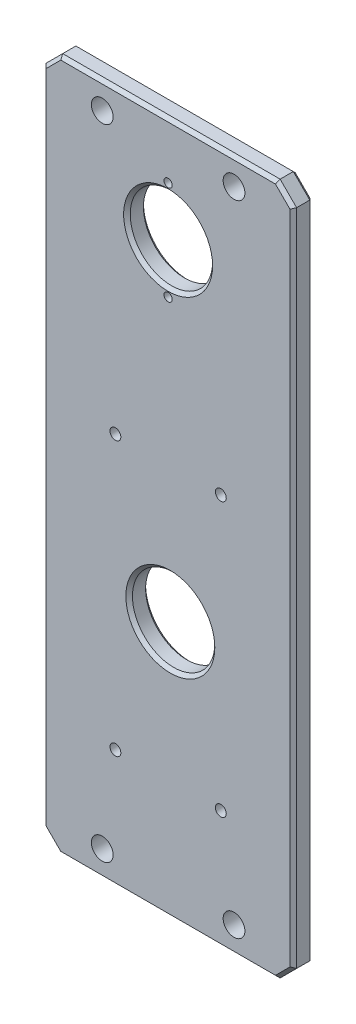
from build123d import *

# Parameters (mm, degrees)
SKETCH_1_W             = 76
SKETCH_1_H             = 210
EXTRUDE_1_DEPTH        = 6
SKETCH_2_R             = 3.3
CUT_EXTRUDE_1_DEPTH    = 112.825757319
CHAMFER_2_SIZE         = 5
CHAMFER_1_SIZE         = 1
HOLE_WIZARD_M4_1_D     = 3.3
HOLE_WIZARD_M4_1_DEPTH = 10.1
HOLE_WIZARD_M4_1_TIP   = 0.991420021
HOLE_WIZARD_M3_1_D     = 2.5
HOLE_WIZARD_M3_1_DEPTH = 7.5
HOLE_WIZARD_M3_1_TIP   = 0.751075774
SKETCH_7_R             = 12.5
CUT_EXTRUDE_2_DEPTH    = 112.825757319
SKETCH_8_R             = 12.5
CUT_EXTRUDE_3_DEPTH    = 112.825757319
CHAMFER_3_SIZE         = 1


with BuildPart() as part:
    # 草图1 → 凸台-拉伸1 (new body)
    with BuildSketch(Plane.XY):
        Rectangle(SKETCH_1_W, SKETCH_1_H)
    extrude(amount=EXTRUDE_1_DEPTH)

    # 草图2 → 切除-拉伸1 (cut, through all)
    with BuildSketch(Plane.XY.offset(6)):
        with Locations((-20, 97)):
            Circle(SKETCH_2_R)
        with Locations((20, 97)):
            Circle(SKETCH_2_R)
        with Locations((-20, -97)):
            Circle(SKETCH_2_R)
        with Locations((20, -97)):
            Circle(SKETCH_2_R)
    extrude(amount=-CUT_EXTRUDE_1_DEPTH, mode=Mode.SUBTRACT)

    # 倒角2
    chamfer_2_edges = [part.edges().sort_by_distance(p)[0] for p in [
        (38, -105, 3),
        (-38, -105, 3),
        (-38, 105, 3),
        (38, 105, 3),
    ]]
    chamfer(chamfer_2_edges, length=CHAMFER_2_SIZE)

    # 倒角1
    chamfer_1_edges = [part.edges().sort_by_distance(p)[0] for p in [
        (0, -105, 0),
        (0, -105, 6),
        (38, 0, 0),
        (-38, 0, 0),
        (0, 105, 0),
        (35.5, 102.5, 0),
        (-35.5, 102.5, 0),
        (35.5, -102.5, 0),
        (-35.5, -102.5, 0),
        (-38, 0, 6),
        (38, 0, 6),
        (0, 105, 6),
        (35.5, 102.5, 6),
        (-35.5, 102.5, 6),
        (35.5, -102.5, 6),
        (-35.5, -102.5, 6),
    ]]
    chamfer(chamfer_1_edges, length=CHAMFER_1_SIZE)

    # M4 螺纹孔1
    with Locations(Plane(origin=(0, 0, 0), x_dir=(-1, 0, 0), z_dir=(0, 0, -1))):
        with Locations((-16, 14), (16, 14), (16, -69), (-16, -69)):
            Hole(HOLE_WIZARD_M4_1_D / 2, depth=HOLE_WIZARD_M4_1_DEPTH)
            with Locations((0, 0, -(HOLE_WIZARD_M4_1_DEPTH + HOLE_WIZARD_M4_1_TIP / 2))):  # 118° drill point
                Cone(0, HOLE_WIZARD_M4_1_D / 2, HOLE_WIZARD_M4_1_TIP, mode=Mode.SUBTRACT)

    # M3 螺纹孔1
    with Locations(Plane(origin=(0, 0, 0), x_dir=(-1, 0, 0), z_dir=(0, 0, -1))):
        with Locations((0, 58), (0, 88)):
            Hole(HOLE_WIZARD_M3_1_D / 2, depth=HOLE_WIZARD_M3_1_DEPTH)
            with Locations((0, 0, -(HOLE_WIZARD_M3_1_DEPTH + HOLE_WIZARD_M3_1_TIP / 2))):  # 118° drill point
                Cone(0, HOLE_WIZARD_M3_1_D / 2, HOLE_WIZARD_M3_1_TIP, mode=Mode.SUBTRACT)

    # 草图7 → 切除-拉伸2 (cut, through all)
    with BuildSketch(Plane(origin=(0, 0, 0), x_dir=(-1, 0, 0), z_dir=(0, 0, -1))):
        with Locations((0, 73)):
            Circle(SKETCH_7_R)
    extrude(amount=-CUT_EXTRUDE_2_DEPTH, mode=Mode.SUBTRACT)

    # 草图8 → 切除-拉伸3 (cut, through all)
    with BuildSketch(Plane(origin=(0, 0, 0), x_dir=(-1, 0, 0), z_dir=(0, 0, -1))):
        with Locations((-0.670705331, -27.019604997)):
            Circle(SKETCH_8_R)
    extrude(amount=-CUT_EXTRUDE_3_DEPTH, mode=Mode.SUBTRACT)

    # 倒角3
    chamfer_3_edges = [part.edges().sort_by_distance(p)[0] for p in [
        (12.5, 73, 6),
        (12.5, 73, 0),
        (13.170705331, -27.019604997, 6),
        (13.170705331, -27.019604997, 0),
    ]]
    chamfer(chamfer_3_edges, length=CHAMFER_3_SIZE)


solid = part.part
